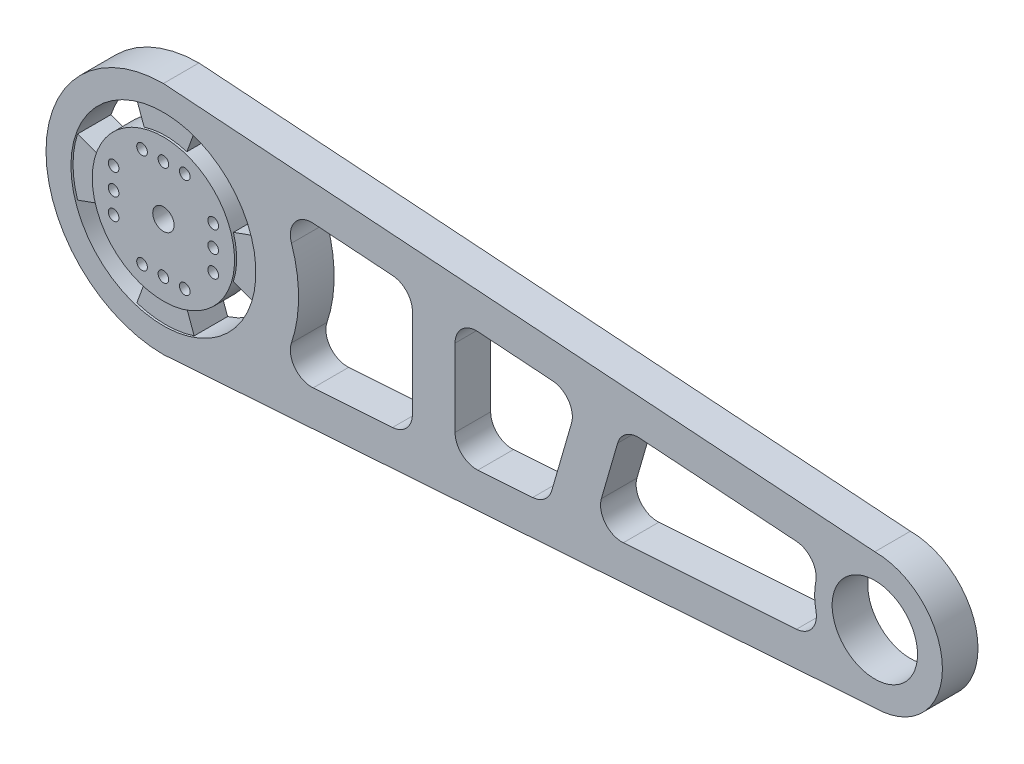
from build123d import *

# Parameters (mm, degrees)
SKETCH_1_R           = 6
EXTRUDE_1_DEPTH      = 5
SKETCH_2_R           = 1.5
SKETCH_2_R_2         = 0.75
CUT_EXTRUDE_3_DEPTH  = 86.605569128
CUT_EXTRUDE_8_DEPTH  = 86.605569128
SKETCH_8_R           = 10
CUT_EXTRUDE_9_DEPTH  = 2
CUT_EXTRUDE_START    = -0.3
CUT_EXTRUDE_10_DEPTH = 0.3


with BuildPart() as part:
    # 草图1 → 凸台-拉伸1 (new body)
    with BuildSketch(Plane.XY):
        with BuildLine():
            Line((-67.351436873, 16.5), (32.648563127, 9.5))
            ThreePointArc((32.648563127, 9.5), (42.148563127, 0), (32.648563127, -9.5))
            Line((32.648563127, -9.5), (-67.351436873, -16.5))
            ThreePointArc((-67.351436873, -16.5), (-83.851436873, 0), (-67.351436873, 16.5))
        make_face()
        with Locations((32.648563127, 0)):
            Circle(SKETCH_1_R, mode=Mode.SUBTRACT)
    extrude(amount=EXTRUDE_1_DEPTH)

    # 草图2 → 切除-拉伸3 (cut, through all)
    with BuildSketch(Plane(origin=(0, 0, 0), x_dir=(-1, 0, 0), z_dir=(0, 0, -1))):
        with Locations((67.351436873, 0)):
            Circle(SKETCH_2_R)
        with Locations((60.351436873, 0)):
            Circle(SKETCH_2_R_2)
        with Locations((60.351436873, 3)):
            Circle(SKETCH_2_R_2)
        with Locations((60.351436873, -3)):
            Circle(SKETCH_2_R_2)
        with Locations((70.351436873, 7)):
            Circle(SKETCH_2_R_2)
        with Locations((67.351436873, 7)):
            Circle(SKETCH_2_R_2)
        with Locations((64.351436873, 7)):
            Circle(SKETCH_2_R_2)
        with Locations((74.351436873, -3)):
            Circle(SKETCH_2_R_2)
        with Locations((74.351436873, 0)):
            Circle(SKETCH_2_R_2)
        with Locations((74.351436873, 3)):
            Circle(SKETCH_2_R_2)
        with Locations((64.351436873, -7)):
            Circle(SKETCH_2_R_2)
        with Locations((67.351436873, -7)):
            Circle(SKETCH_2_R_2)
        with Locations((70.351436873, -7)):
            Circle(SKETCH_2_R_2)
        with BuildLine():
            Line((70.351436873, 9.539392014), (71.378274732, 12.360605845))
            ThreePointArc((71.378274732, 12.360605845), (76.543825029, 9.192388155), (79.712042718, 4.026837859))
            Line((79.712042718, 4.026837859), (76.890828887, 3))
            ThreePointArc((76.890828887, 3), (74.422504685, 7.071067812), (70.351436873, 9.539392014))
        make_face()
        with BuildLine():
            Line((64.351436873, 9.539392014), (63.324599014, 12.360605845))
            ThreePointArc((63.324599014, 12.360605845), (58.159048718, 9.192388155), (54.990831028, 4.026837859))
            Line((54.990831028, 4.026837859), (57.812044859, 3))
            ThreePointArc((57.812044859, 3), (60.280369061, 7.071067812), (64.351436873, 9.539392014))
        make_face()
        with BuildLine():
            Line((76.890828887, -3), (79.712042718, -4.026837859))
            ThreePointArc((79.712042718, -4.026837859), (76.543825029, -9.192388155), (71.378274732, -12.360605845))
            Line((71.378274732, -12.360605845), (70.351436873, -9.539392014))
            ThreePointArc((70.351436873, -9.539392014), (74.422504685, -7.071067812), (76.890828887, -3))
        make_face()
        with BuildLine():
            Line((64.351436873, -9.539392014), (63.324599014, -12.360605845))
            ThreePointArc((63.324599014, -12.360605845), (58.159048718, -9.192388155), (54.990831028, -4.026837859))
            Line((54.990831028, -4.026837859), (57.812044859, -3))
            ThreePointArc((57.812044859, -3), (60.280369061, -7.071067812), (64.351436873, -9.539392014))
        make_face()
    extrude(amount=-CUT_EXTRUDE_3_DEPTH, mode=Mode.SUBTRACT)

    # 草图7 → 切除-拉伸8 (cut, through all)
    with BuildSketch(Plane.XY.offset(5)):
        with BuildLine():
            Line((-32.351436873, 6.240423951), (-32.351436873, -6.279908436))
            ThreePointArc((-32.351436873, -6.279908436), (-33.159771035, -8.328469115), (-35.149170775, -9.273082074))
            Line((-35.149170775, -9.273082074), (-46.303856397, -10.026868861))
            ThreePointArc((-46.303856397, -10.026868861), (-48.882666549, -8.864552498), (-49.348665365, -6.074554966))
            ThreePointArc((-49.348665365, -6.074554966), (-48.351437761, -0.005807318), (-49.344955374, 6.063548799))
            ThreePointArc((-49.344955374, 6.063548799), (-48.875599725, 8.855399851), (-46.292339334, 10.013628142))
            Line((-46.292339334, 10.013628142), (-35.14194949, 9.233100853))
            ThreePointArc((-35.14194949, 9.233100853), (-33.157301263, 8.286339132), (-32.351436873, 6.240423951))
        make_face()
        with BuildLine():
            Line((-23.14194949, 8.393100853), (-12.658599808, 7.659266375))
            ThreePointArc((-12.658599808, 7.659266375), (-10.408556973, 6.384352876), (-9.986244931, 3.832931757))
            Line((-9.986244931, 3.832931757), (-12.767703456, -5.782195127))
            ThreePointArc((-12.767703456, -5.782195127), (-13.767045159, -7.284386647), (-15.447279617, -7.941711049))
            Line((-15.447279617, -7.941711049), (-23.149170775, -8.462172493))
            ThreePointArc((-23.149170775, -8.462172493), (-25.399997551, -7.660664694), (-26.351436873, -5.468998855))
            Line((-26.351436873, -5.468998855), (-26.351436873, 5.400423951))
            ThreePointArc((-26.351436873, 5.400423951), (-25.397352054, 7.594559561), (-23.14194949, 8.393100853))
        make_face()
        with BuildLine():
            Line((-3.505857343, 4.643162142), (-5.790312558, -3.25389135))
            ThreePointArc((-5.790312558, -3.25389135), (-5.244319535, -5.970049623), (-2.7062042, -7.080722705))
            Line((-2.7062042, -7.080722705), (21.637024401, -5.435709596))
            ThreePointArc((21.637024401, -5.435709596), (23.82451027, -4.256119574), (24.371955288, -1.831901968))
            ThreePointArc((24.371955288, -1.831901968), (24.183794233, -0.066811207), (24.345729084, 1.700878551))
            ThreePointArc((24.345729084, 1.700878551), (23.778220575, 4.09624397), (21.609277414, 5.26051497))
            Line((21.609277414, 5.26051497), (-0.414527699, 6.802181327))
            ThreePointArc((-0.414527699, 6.802181327), (-2.341778485, 6.269034644), (-3.505857343, 4.643162142))
        make_face()
    extrude(amount=-CUT_EXTRUDE_8_DEPTH, mode=Mode.SUBTRACT)

    # 草图8 → 切除-拉伸9 (cut)
    with BuildSketch(Plane(origin=(0, 0, 0), x_dir=(-1, 0, 0), z_dir=(0, 0, -1))):
        with Locations((67.351436873, 0)):
            Circle(SKETCH_8_R)
    extrude(amount=-CUT_EXTRUDE_9_DEPTH, mode=Mode.SUBTRACT)

    # 草图9 → 切除-拉伸10 (cut)
    with BuildSketch(Plane.XY.offset(5).offset(CUT_EXTRUDE_START)):
        with BuildLine():
            Line((-64.351436873, 9.539392014), (-63.324599014, 12.360605845))
            ThreePointArc((-63.324599014, 12.360605845), (-67.351436873, 13), (-71.378274732, 12.360605845))
            Line((-71.378274732, 12.360605845), (-70.351436873, 9.539392014))
            ThreePointArc((-70.351436873, 9.539392014), (-67.351436873, 10), (-64.351436873, 9.539392014))
        make_face()
        with BuildLine():
            ThreePointArc((-57.812044859, -3), (-57.351436873, 0), (-57.812044859, 3))
            Line((-57.812044859, 3), (-54.990831028, 4.026837859))
            ThreePointArc((-54.990831028, 4.026837859), (-54.351436873, 0), (-54.990831028, -4.026837859))
            Line((-54.990831028, -4.026837859), (-57.812044859, -3))
        make_face()
        with BuildLine():
            ThreePointArc((-70.351436873, -9.539392014), (-67.351436873, -10), (-64.351436873, -9.539392014))
            Line((-64.351436873, -9.539392014), (-63.324599014, -12.360605845))
            ThreePointArc((-63.324599014, -12.360605845), (-67.351436873, -13), (-71.378274732, -12.360605845))
            Line((-71.378274732, -12.360605845), (-70.351436873, -9.539392014))
        make_face()
        with BuildLine():
            ThreePointArc((-76.890828887, 3), (-77.351436873, 0), (-76.890828887, -3))
            Line((-76.890828887, -3), (-79.712042718, -4.026837859))
            ThreePointArc((-79.712042718, -4.026837859), (-80.351436873, 0), (-79.712042718, 4.026837859))
            Line((-79.712042718, 4.026837859), (-76.890828887, 3))
        make_face()
    extrude(amount=CUT_EXTRUDE_10_DEPTH, mode=Mode.SUBTRACT)


solid = part.part
